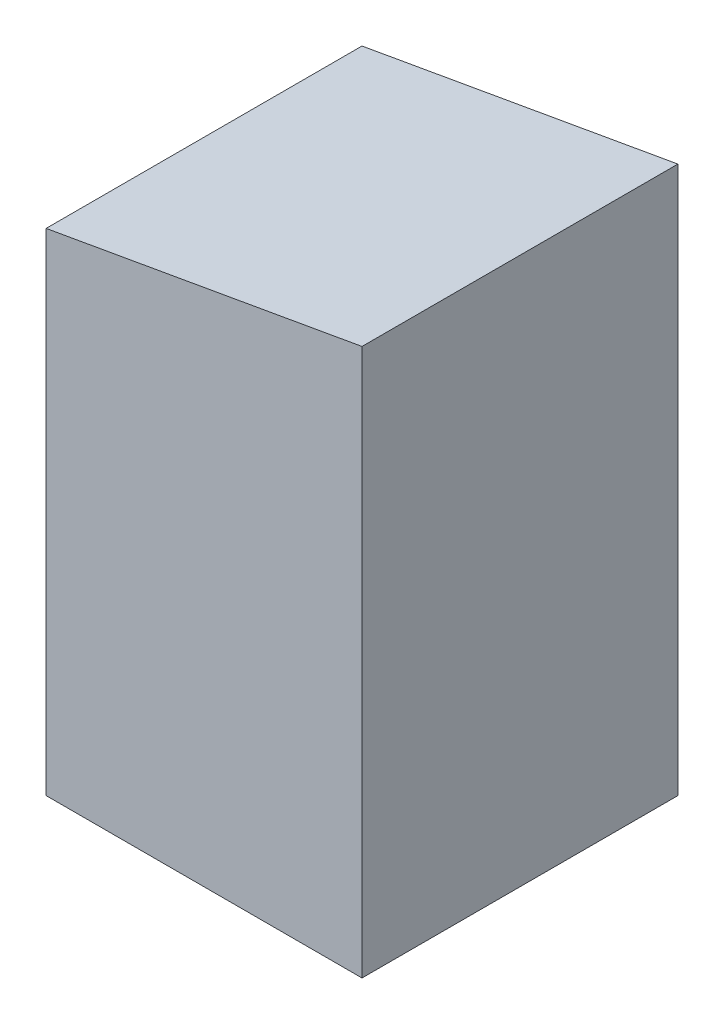
from build123d import *

# Parameters (mm, degrees)
BOSS_EXTRUDE1_DEPTH = 50.8


with BuildPart() as part:
    # Sketch2 → Boss-Extrude1 (new body)
    with BuildSketch(Plane.XY):
        Polygon((50.8, 87.95741062), (0, 79), (0, 0), (50.8, 0), align=None)
    extrude(amount=BOSS_EXTRUDE1_DEPTH)


solid = part.part
